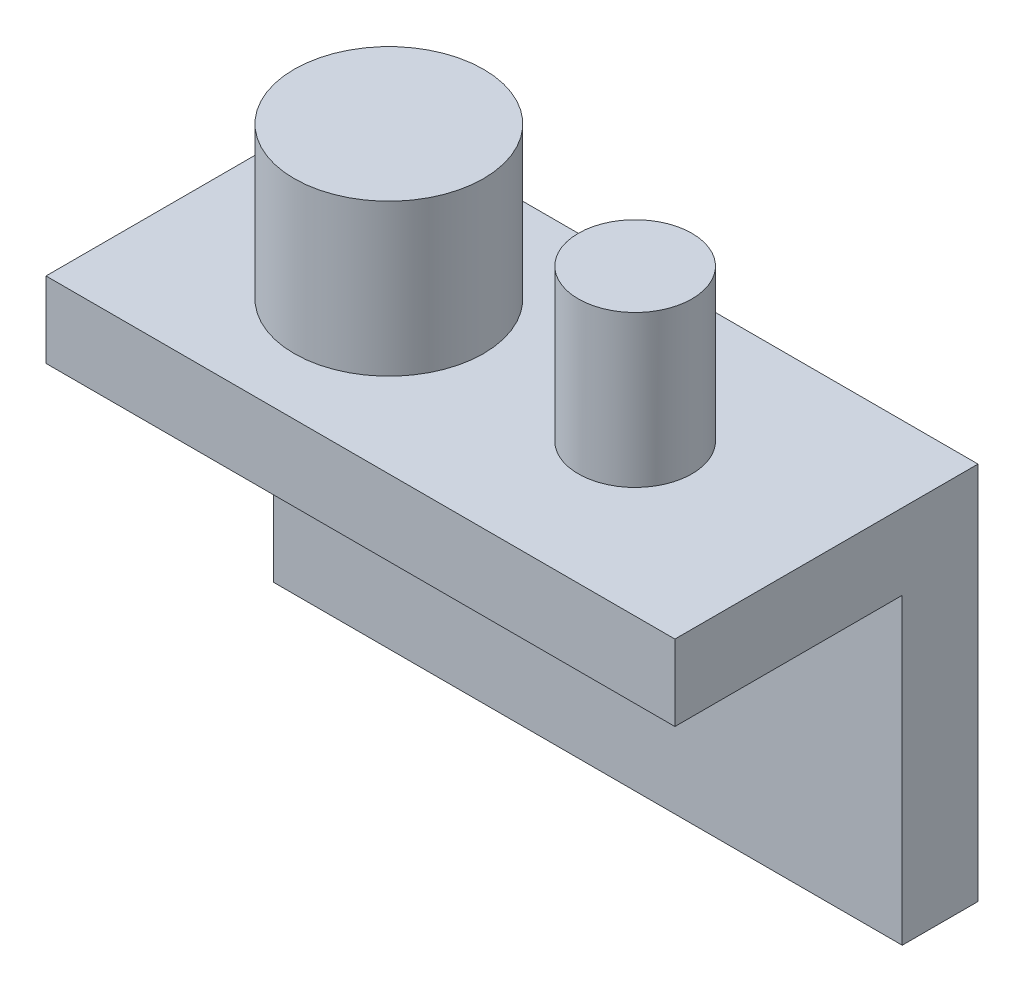
from build123d import *

# Parameters (mm, degrees)
SKETCH1_W           = 16.6
SKETCH1_H           = 8
BOSS_EXTRUDE1_DEPTH = 2
SKETCH2_R           = 2.5
SKETCH2_R_2         = 1.5
BOSS_EXTRUDE2_DEPTH = 4
SKETCH3_W           = 16.6
SKETCH3_H           = 2
BOSS_EXTRUDE3_DEPTH = 8


with BuildPart() as part:
    # Sketch1 → Boss-Extrude1 (new body)
    with BuildSketch(Plane(origin=(0, 0, 0), x_dir=(1, 0, 0), z_dir=(0, 1, 0))):
        Rectangle(SKETCH1_W, SKETCH1_H)
    extrude(amount=BOSS_EXTRUDE1_DEPTH)

    # Sketch2 → Boss-Extrude2 (add)
    with BuildSketch(Plane(origin=(0, 2, 0), x_dir=(1, 0, 0), z_dir=(0, 1, 0))):
        with Locations(Location((-3.25, 0, 0), (0, 0, 90))):
            Circle(SKETCH2_R)
        with Locations(Location((3.25, 0, 0), (0, 0, 90))):
            Circle(SKETCH2_R_2)
    extrude(amount=BOSS_EXTRUDE2_DEPTH)

    # Sketch3 → Boss-Extrude3 (add)
    with BuildSketch(Plane.XZ):
        with Locations((0, -3)):
            Rectangle(SKETCH3_W, SKETCH3_H)
    extrude(amount=BOSS_EXTRUDE3_DEPTH)


solid = part.part
